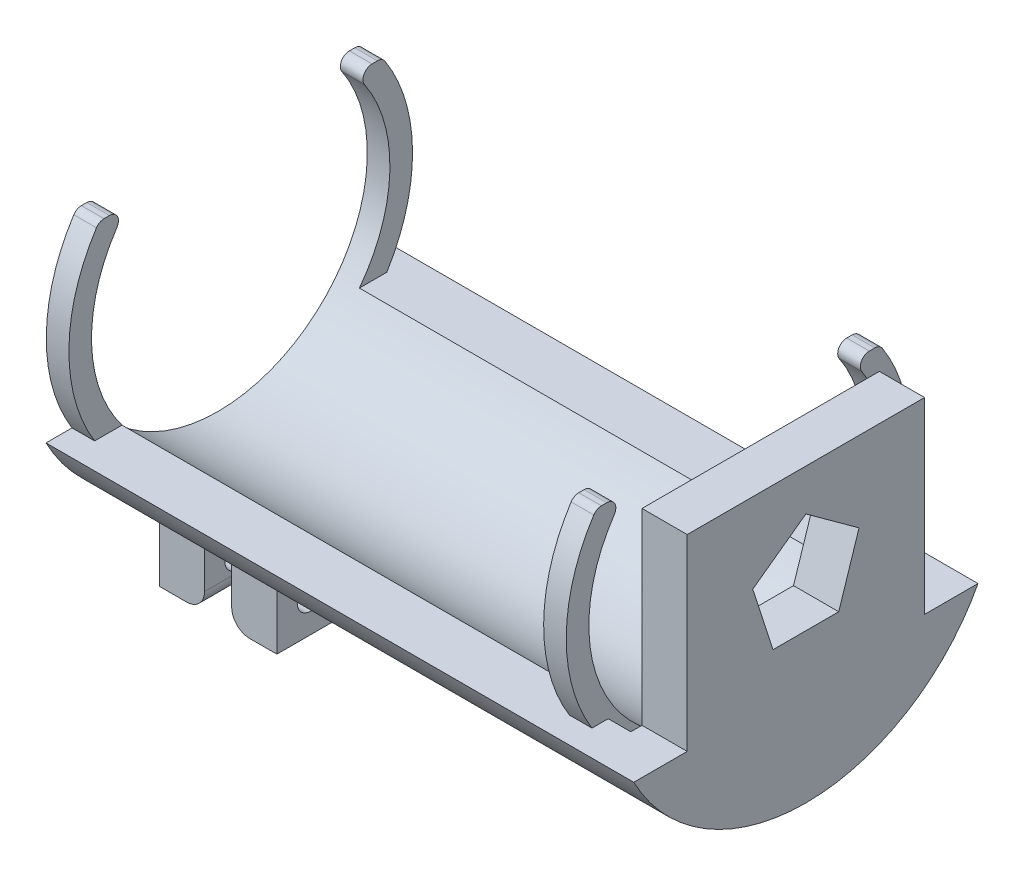
from build123d import *

# Parameters (mm, degrees)
BOSS_EXTRUDE1_DEPTH      = 60
BOSS_EXTRUDE2_START      = -5
BOSS_EXTRUDE2_DEPTH      = 5
BOSS_EXTRUDE3_START      = 10
BOSS_EXTRUDE3_DEPTH      = 10
BOSS_EXTRUDE4_DEPTH      = 15
BOSS_EXTRUDE4_2_DEPTH    = 15
BOSS_EXTRUDE6_REACH      = 104.54
BOSS_EXTRUDE6_END_RADIUS = 43
SKETCH5_W                = 10
SKETCH5_H                = 30
CUT_EXTRUDE1_REACH       = 147.592
SKETCH6_R                = 3
SKETCH7_R                = 35
CUT_EXTRUDE2_DEPTH       = 5
LPATTERN1_COUNT          = 2
LPATTERN1_PITCH          = 110
FILLET1_R                = 2
CUT_EXTRUDE3_REACH       = 140.611


with BuildPart() as part:
    # Sketch1 → Boss-Extrude1 (new, symmetric)
    with BuildSketch(Plane(origin=(0, 0, 0), x_dir=(0, 0, -1), z_dir=(1, 0, 0))):
        with BuildLine():
            Line((-38.065732621, -20), (-26.248809497, -20))
            ThreePointArc((-26.248809497, -20), (0, -33), (26.248809497, -20))
            Line((26.248809497, -20), (38.065732621, -20))
            ThreePointArc((38.065732621, -20), (0, -43), (-38.065732621, -20))
        make_face()
    extrude(amount=BOSS_EXTRUDE1_DEPTH, both=True)

    # Sketch2 → Boss-Extrude2 (add)
    with BuildSketch(Plane(origin=(60, 0, 0), x_dir=(0, 0, -1), z_dir=(1, 0, 0)).offset(BOSS_EXTRUDE2_START)):
        with BuildLine():
            Line((-31.304951685, 21.540659229), (-25, 21.540659229))
            ThreePointArc((-25, 21.540659229), (0, -33), (25, 21.540659229))
            Line((25, 21.540659229), (31.304951685, 21.540659229))
            ThreePointArc((31.304951685, 21.540659229), (0, -38), (-31.304951685, 21.540659229))
        make_face()
    boss_extrude2 = extrude(amount=-BOSS_EXTRUDE2_DEPTH)

    # Sketch3 → Boss-Extrude3 (add)
    with BuildSketch(Plane(origin=(60, 0, 0), x_dir=(0, 0, -1), z_dir=(1, 0, 0)).offset(BOSS_EXTRUDE3_START)):
        with BuildLine():
            Line((-26.248809497, -20), (-26.248809497, 21.540659229))
            Line((-26.248809497, 21.540659229), (26.248809497, 21.540659229))
            Line((26.248809497, 21.540659229), (26.248809497, -20))
            Line((26.248809497, -20), (38.065732621, -20))
            ThreePointArc((38.065732621, -20), (0, -43), (-38.065732621, -20))
            Line((-38.065732621, -20), (-26.248809497, -20))
        make_face()
    extrude(amount=-BOSS_EXTRUDE3_DEPTH)



with BuildPart() as body_2:
    # Sketch4 → Boss-Extrude4 (new, symmetric)
    with BuildSketch(Plane.XY):
        with BuildLine():
            Line((-48, -43), (-48, -54))
            ThreePointArc((-48, -54), (-49.171572875, -56.828427125), (-52, -58))
            Line((-52, -58), (-58, -58))
            Line((-58, -58), (-58, -43))
            Line((-58, -43), (-48, -43))
        make_face()
    extrude(amount=BOSS_EXTRUDE4_DEPTH, both=True)


with BuildPart() as body_3:
    # Sketch4 → Boss-Extrude4 2 (new, symmetric)
    with BuildSketch(Plane.XY):
        with BuildLine():
            Line((-32, -43), (-42, -43))
            Line((-42, -43), (-42, -54))
            ThreePointArc((-42, -54), (-40.828427125, -56.828427125), (-38, -58))
            Line((-38, -58), (-32, -58))
            Line((-32, -58), (-32, -43))
        make_face()
    extrude(amount=BOSS_EXTRUDE4_2_DEPTH, both=True)


with BuildPart() as part_1:
    add(part.part)

    add(body_2.part)  # Boss-Extrude6 merges body 2

    add(body_3.part)  # Boss-Extrude6 merges body 3
    # Boss-Extrude6: up to this cylinder (the profile starts outside it)
    boss_extrude6_end = Plane(origin=(-45, 0, 0), z_dir=(-1, 0, 0)) * Cylinder(BOSS_EXTRUDE6_END_RADIUS, 312.08, mode=Mode.PRIVATE)
    # Sketch5 → Boss-Extrude6 (add, up to the surface)
    with BuildSketch(Plane(origin=(0, -43, 0), x_dir=(1, 0, 0), z_dir=(0, 1, 0)), mode=Mode.PRIVATE) as boss_extrude6_sk1:
        with Locations((-37, 0)):
            Rectangle(SKETCH5_W, SKETCH5_H)
    boss_extrude6_tool1 = extrude(boss_extrude6_sk1.sketch, amount=BOSS_EXTRUDE6_REACH, mode=Mode.PRIVATE) - boss_extrude6_end
    add(boss_extrude6_tool1.solids().sort_by_distance((-37, -43, 0))[0])
    add(boss_extrude6_tool1.solids().sort_by_distance((-37, -43, 0))[1])
    # Sketch5 → Boss-Extrude6 (add, up to the surface)
    with BuildSketch(Plane(origin=(0, -43, 0), x_dir=(1, 0, 0), z_dir=(0, 1, 0)), mode=Mode.PRIVATE) as boss_extrude6_sk2:
        with Locations((-53, 0)):
            Rectangle(SKETCH5_W, SKETCH5_H)
    boss_extrude6_tool2 = extrude(boss_extrude6_sk2.sketch, amount=BOSS_EXTRUDE6_REACH, mode=Mode.PRIVATE) - boss_extrude6_end
    add(boss_extrude6_tool2.solids().sort_by_distance((-53, -43, 0))[0])
    add(boss_extrude6_tool2.solids().sort_by_distance((-53, -43, 0))[1])

    # Cut-Extrude1: up to this face of the body (flat: up to its plane)
    cut_extrude1_end = Plane(part_1.part.faces().sort_by_distance((-32, -50.035411039, 0))[0])
    # Sketch6 → Cut-Extrude1 (cut, up to the picked face)
    with BuildSketch(Plane.ZY.offset(58), mode=Mode.PRIVATE) as cut_extrude1_sk1:
        with Locations((-7.5, -50.5)):
            Circle(SKETCH6_R)
    cut_extrude1_tool1 = split(extrude(cut_extrude1_sk1.sketch, amount=-CUT_EXTRUDE1_REACH, mode=Mode.PRIVATE), bisect_by=cut_extrude1_end, keep=Keep.BOTH, mode=Mode.PRIVATE)
    # Sketch6 → Cut-Extrude1 (cut, up to the picked face)
    with BuildSketch(Plane.ZY.offset(58), mode=Mode.PRIVATE) as cut_extrude1_sk2:
        with Locations((7.5, -50.5)):
            Circle(SKETCH6_R)
    cut_extrude1_tool2 = split(extrude(cut_extrude1_sk2.sketch, amount=-CUT_EXTRUDE1_REACH, mode=Mode.PRIVATE), bisect_by=cut_extrude1_end, keep=Keep.BOTH, mode=Mode.PRIVATE)
    add(cut_extrude1_tool1.solids().sort_by(Axis((-58, -50.5, -7.5), (1, 0, 0)))[0], mode=Mode.SUBTRACT)
    add(cut_extrude1_tool2.solids().sort_by(Axis((-58, -50.5, 7.5), (1, 0, 0)))[0], mode=Mode.SUBTRACT)

    # Sketch7 → Cut-Extrude2 (cut)
    with BuildSketch(Plane.ZY.offset(-60)):
        Circle(SKETCH7_R)
    extrude(amount=CUT_EXTRUDE2_DEPTH, mode=Mode.SUBTRACT)

    # LPattern1: Boss-Extrude2 ×2
    with Locations(*[(-i * LPATTERN1_PITCH, 0, 0) for i in range(1, LPATTERN1_COUNT)]):
        add(boss_extrude2)

    # Fillet1
    fillet1_edges = [part_1.edges().sort_by_distance(p)[0] for p in [
        (52.5, 21.540659229, 25),
        (52.5, 21.540659229, -31.304951685),
        (52.5, 21.540659229, -25),
        (-57.5, 21.540659229, 25),
        (-57.5, 21.540659229, -31.304951685),
        (-57.5, 21.540659229, -25),
        (-57.5, 21.540659229, 31.304951685),
        (52.5, 21.540659229, 31.304951685),
    ]]
    fillet(fillet1_edges, radius=FILLET1_R)

    # Sketch8 → Cut-Extrude3 (cut, up to next)
    with BuildSketch(Plane.ZY.offset(-60), mode=Mode.PRIVATE) as cut_extrude3_sk1:
        Polygon((0, 12.360679775), (-11.755705046, 3.819660113), (-7.26542528, -10), (7.26542528, -10), (11.755705046, 3.819660113), align=None)
    cut_extrude3_tool1 = extrude(cut_extrude3_sk1.sketch, amount=-CUT_EXTRUDE3_REACH, mode=Mode.PRIVATE) & part_1.part
    add(cut_extrude3_tool1.solids().sort_by_distance((60, 0, 0))[0], mode=Mode.SUBTRACT)


solid = part_1.part
